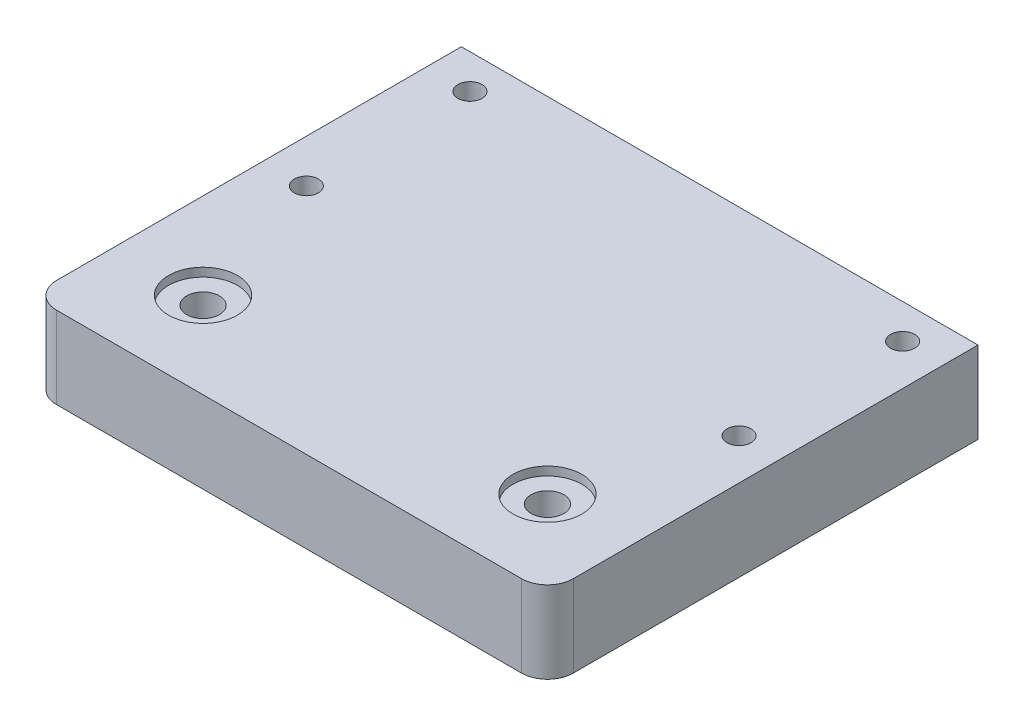
from build123d import *

# Parameters (mm, degrees)
SKETCH_1_W          = 60
SKETCH_1_H          = 50
EXTRUDE_1_DEPTH     = 9.5
FILLET_1_R          = 3
SKETCH_2_R          = 4
CUT_EXTRUDE_1_DEPTH = 1
SKETCH_5_R          = 1.9
CUT_EXTRUDE_3_DEPTH = 41.190172928
SKETCH_6_R          = 1.4
CUT_EXTRUDE_4_DEPTH = 41.190172928
CUT_EXTRUDE_START   = -4
SKETCH_7_R          = 4
SKETCH_7_R_2        = 3
CUT_EXTRUDE_5_DEPTH = 4


with BuildPart() as part:
    # 草图1 → 凸台-拉伸1 (new body)
    with BuildSketch(Plane(origin=(0, 0, 0), x_dir=(1, 0, 0), z_dir=(0, 1, 0))):
        Rectangle(SKETCH_1_W, SKETCH_1_H)
    extrude(amount=EXTRUDE_1_DEPTH)

    # 圆角1
    fillet_1_edges = [part.edges().sort_by_distance(p)[0] for p in [
        (30, 4.75, 25),
        (-30, 4.75, 25),
    ]]
    fillet(fillet_1_edges, radius=FILLET_1_R)

    # 草图2 → 切除-拉伸1 (cut)
    with BuildSketch(Plane(origin=(0, 9.5, 0), x_dir=(1, 0, 0), z_dir=(0, 1, 0))):
        with Locations(Location((-20, -15, 0), (0, 0, 270))):
            Circle(SKETCH_2_R)
        with Locations(Location((20, -15, 0), (0, 0, 270))):
            Circle(SKETCH_2_R)
    extrude(amount=-CUT_EXTRUDE_1_DEPTH, mode=Mode.SUBTRACT)

    # 草图5 → 切除-拉伸3 (cut, through all)
    with BuildSketch(Plane(origin=(0, 9.5, 0), x_dir=(1, 0, 0), z_dir=(0, 1, 0))):
        with Locations(Location((-20, -15, 0), (0, 0, 270))):
            Circle(SKETCH_5_R)
        with Locations(Location((20, -15, 0), (0, 0, 270))):
            Circle(SKETCH_5_R)
    extrude(amount=-CUT_EXTRUDE_3_DEPTH, mode=Mode.SUBTRACT)

    # 草图6 → 切除-拉伸4 (cut, through all)
    with BuildSketch(Plane.XZ):
        with Locations(Location((-25, -21, 0), (0, 0, 270))):
            Circle(SKETCH_6_R)
        with Locations(Location((-25, -2, 0), (0, 0, 270))):
            Circle(SKETCH_6_R)
        with Locations(Location((25.25, -21, 0), (0, 0, 270))):
            Circle(SKETCH_6_R)
        with Locations(Location((25.25, -2, 0), (0, 0, 270))):
            Circle(SKETCH_6_R)
    extrude(amount=-CUT_EXTRUDE_4_DEPTH, mode=Mode.SUBTRACT)

    # 草图7 → 切除-拉伸5 (cut)
    with BuildSketch(Plane.XZ.offset(CUT_EXTRUDE_START)):
        with Locations(Location((-20, 15, 0), (0, 0, 90))):
            Circle(SKETCH_7_R)
        with Locations(Location((20, 15, 0), (0, 0, 90))):
            Circle(SKETCH_7_R)
        with Locations(Location((25.25, -2, 0), (0, 0, 270))):
            Circle(SKETCH_7_R_2)
        with Locations(Location((25.25, -21, 0), (0, 0, 270))):
            Circle(SKETCH_7_R_2)
        with Locations(Location((-25, -21, 0), (0, 0, 270))):
            Circle(SKETCH_7_R_2)
        with Locations(Location((-25, -2, 0), (0, 0, 270))):
            Circle(SKETCH_7_R_2)
    extrude(amount=CUT_EXTRUDE_5_DEPTH, mode=Mode.SUBTRACT)


solid = part.part
